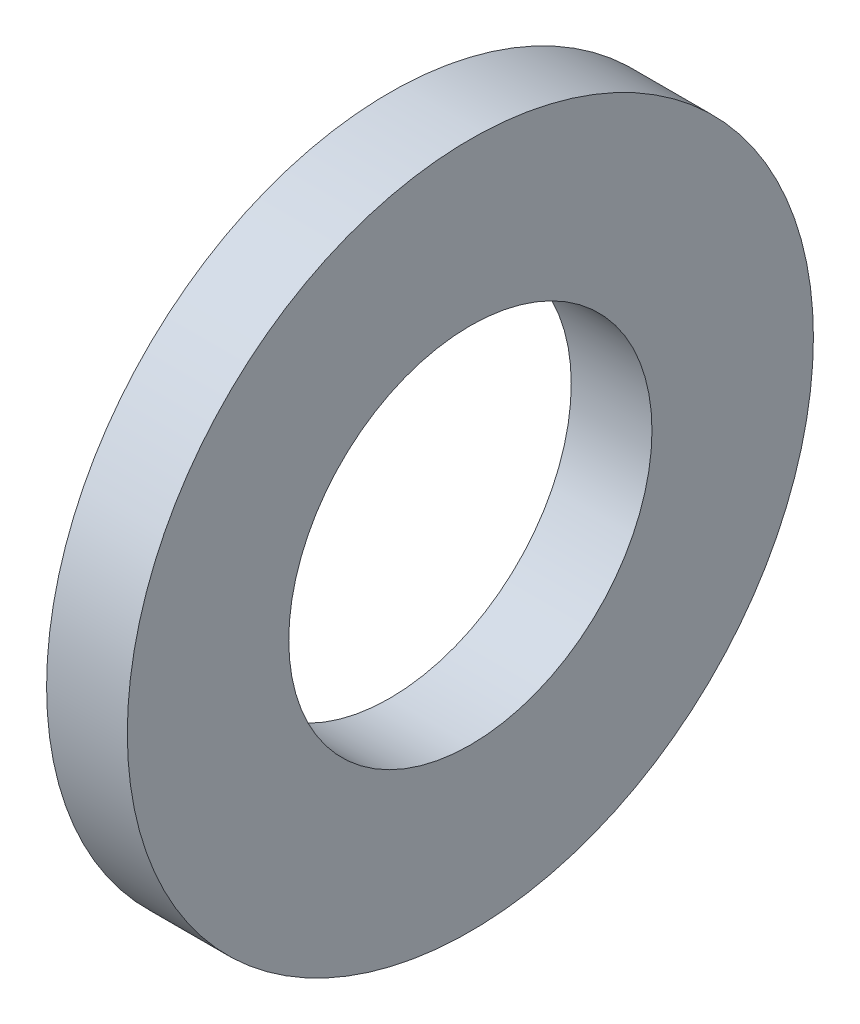
from build123d import *

# Parameters (mm, degrees)
SKETCH1_W = 4
SKETCH1_H = 8


with BuildPart() as part:
    # Sketch1 → Base-Revolve (revolve)
    with BuildSketch(Plane.XY, mode=Mode.PRIVATE) as base_revolve_sk:
        with Locations((-2, 13)):
            Rectangle(SKETCH1_W, SKETCH1_H)
    revolve(base_revolve_sk.sketch.rotate(Axis((-34.925, 0, 0), (1, 0, 0)), 90), axis=Axis((-34.925, 0, 0), (1, 0, 0)))


solid = part.part
